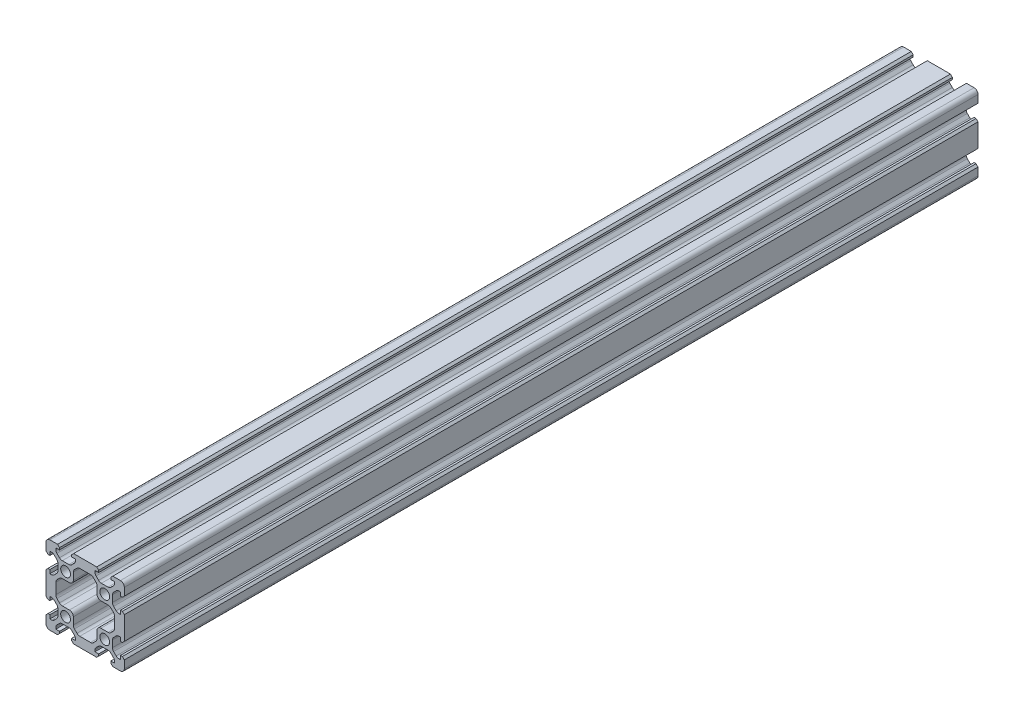
from build123d import *

# Parameters (mm, degrees)
SKETCH1_R           = 2.5
BOSS_EXTRUDE1_DEPTH = 436


with BuildPart() as part:
    # Sketch1 → Boss-Extrude1 (new body)
    with BuildSketch(Plane.XY):
        with BuildLine():
            Line((-13.1, -19), (-14.1, -20))
            Line((-14.1, -20), (-18, -20))
            ThreePointArc((-18, -20), (-19.414213562, -19.414213562), (-20, -18))
            Line((-20, -18), (-20, -14.1))
            Line((-20, -14.1), (-19, -13.1))
            Line((-19, -13.1), (-18, -13.1))
            Line((-18, -13.1), (-18, -15))
            Line((-18, -15), (-17.242640687, -15))
            ThreePointArc((-17.242640687, -15), (-16.477273822, -14.847759065), (-15.828427125, -14.414213562))
            Line((-15.828427125, -14.414213562), (-14.537854624, -13.123641061))
            ThreePointArc((-14.537854624, -13.123641061), (-14.104309121, -12.474794364), (-13.952068186, -11.709427499))
            Line((-13.952068186, -11.709427499), (-13.952068186, -8.290572501))
            ThreePointArc((-13.952068186, -8.290572501), (-14.104309121, -7.525205636), (-14.537854624, -6.876358939))
            Line((-14.537854624, -6.876358939), (-15.828427125, -5.585786438))
            ThreePointArc((-15.828427125, -5.585786438), (-16.477273822, -5.152240935), (-17.242640687, -5))
            Line((-17.242640687, -5), (-18, -5))
            Line((-18, -5), (-18, -6.9))
            Line((-18, -6.9), (-19, -6.9))
            Line((-19, -6.9), (-20, -5.9))
            Line((-20, -5.9), (-20, 5.9))
            Line((-20, 5.9), (-19, 6.9))
            Line((-19, 6.9), (-18, 6.9))
            Line((-18, 6.9), (-18, 5))
            Line((-18, 5), (-17.242640687, 5))
            ThreePointArc((-17.242640687, 5), (-16.477273822, 5.152240935), (-15.828427125, 5.585786438))
            Line((-15.828427125, 5.585786438), (-14.537854624, 6.876358939))
            ThreePointArc((-14.537854624, 6.876358939), (-14.104309121, 7.525205636), (-13.952068186, 8.290572501))
            Line((-13.952068186, 8.290572501), (-13.952068186, 11.709427499))
            ThreePointArc((-13.952068186, 11.709427499), (-14.104309121, 12.474794364), (-14.537854624, 13.123641061))
            Line((-14.537854624, 13.123641061), (-15.828427125, 14.414213562))
            ThreePointArc((-15.828427125, 14.414213562), (-16.477273822, 14.847759065), (-17.242640687, 15))
            Line((-17.242640687, 15), (-18, 15))
            Line((-18, 15), (-18, 13.1))
            Line((-18, 13.1), (-19, 13.1))
            Line((-19, 13.1), (-20, 14.1))
            Line((-20, 14.1), (-20, 18))
            ThreePointArc((-20, 18), (-19.414213562, 19.414213562), (-18, 20))
            Line((-18, 20), (-14.1, 20))
            Line((-14.1, 20), (-13.1, 19))
            Line((-13.1, 19), (-13.1, 18))
            Line((-13.1, 18), (-15, 18))
            Line((-15, 18), (-15, 17.242640687))
            ThreePointArc((-15, 17.242640687), (-14.847759065, 16.477273822), (-14.414213562, 15.828427125))
            Line((-14.414213562, 15.828427125), (-13.123641061, 14.537854624))
            ThreePointArc((-13.123641061, 14.537854624), (-12.474794364, 14.104309121), (-11.709427499, 13.952068186))
            Line((-11.709427499, 13.952068186), (-8.290572501, 13.952068186))
            ThreePointArc((-8.290572501, 13.952068186), (-7.525205636, 14.104309121), (-6.876358939, 14.537854624))
            Line((-6.876358939, 14.537854624), (-5.585786438, 15.828427125))
            ThreePointArc((-5.585786438, 15.828427125), (-5.152240935, 16.477273822), (-5, 17.242640687))
            Line((-5, 17.242640687), (-5, 18))
            Line((-5, 18), (-6.9, 18))
            Line((-6.9, 18), (-6.9, 19))
            Line((-6.9, 19), (-5.9, 20))
            Line((-5.9, 20), (5.9, 20))
            Line((5.9, 20), (6.9, 19))
            Line((6.9, 19), (6.9, 18))
            Line((6.9, 18), (5, 18))
            Line((5, 18), (5, 17.242640687))
            ThreePointArc((5, 17.242640687), (5.152240935, 16.477273822), (5.585786438, 15.828427125))
            Line((5.585786438, 15.828427125), (6.876358939, 14.537854624))
            ThreePointArc((6.876358939, 14.537854624), (7.525205636, 14.104309121), (8.290572501, 13.952068186))
            Line((8.290572501, 13.952068186), (11.709427499, 13.952068186))
            ThreePointArc((11.709427499, 13.952068186), (12.474794364, 14.104309121), (13.123641061, 14.537854624))
            Line((13.123641061, 14.537854624), (14.414213562, 15.828427125))
            ThreePointArc((14.414213562, 15.828427125), (14.847759065, 16.477273822), (15, 17.242640687))
            Line((15, 17.242640687), (15, 18))
            Line((15, 18), (13.1, 18))
            Line((13.1, 18), (13.1, 19))
            Line((13.1, 19), (14.1, 20))
            Line((14.1, 20), (18, 20))
            ThreePointArc((18, 20), (19.414213562, 19.414213562), (20, 18))
            Line((20, 18), (20, 14.1))
            Line((20, 14.1), (19, 13.1))
            Line((19, 13.1), (18, 13.1))
            Line((18, 13.1), (18, 15))
            Line((18, 15), (17.242640687, 15))
            ThreePointArc((17.242640687, 15), (16.477273822, 14.847759065), (15.828427125, 14.414213562))
            Line((15.828427125, 14.414213562), (14.537854624, 13.123641061))
            ThreePointArc((14.537854624, 13.123641061), (14.104309121, 12.474794364), (13.952068186, 11.709427499))
            Line((13.952068186, 11.709427499), (13.952068186, 8.290572501))
            ThreePointArc((13.952068186, 8.290572501), (14.104309121, 7.525205636), (14.537854624, 6.876358939))
            Line((14.537854624, 6.876358939), (15.828427125, 5.585786438))
            ThreePointArc((15.828427125, 5.585786438), (16.477273822, 5.152240935), (17.242640687, 5))
            Line((17.242640687, 5), (18, 5))
            Line((18, 5), (18, 6.9))
            Line((18, 6.9), (19, 6.9))
            Line((19, 6.9), (20, 5.9))
            Line((20, 5.9), (20, -5.9))
            Line((20, -5.9), (19, -6.9))
            Line((19, -6.9), (18, -6.9))
            Line((18, -6.9), (18, -5))
            Line((18, -5), (17.242640687, -5))
            ThreePointArc((17.242640687, -5), (16.477273822, -5.152240935), (15.828427125, -5.585786438))
            Line((15.828427125, -5.585786438), (14.537854624, -6.876358939))
            ThreePointArc((14.537854624, -6.876358939), (14.104309121, -7.525205636), (13.952068186, -8.290572501))
            Line((13.952068186, -8.290572501), (13.952068186, -11.709427499))
            ThreePointArc((13.952068186, -11.709427499), (14.104309121, -12.474794364), (14.537854624, -13.123641061))
            Line((14.537854624, -13.123641061), (15.828427125, -14.414213562))
            ThreePointArc((15.828427125, -14.414213562), (16.477273822, -14.847759065), (17.242640687, -15))
            Line((17.242640687, -15), (18, -15))
            Line((18, -15), (18, -13.1))
            Line((18, -13.1), (19, -13.1))
            Line((19, -13.1), (20, -14.1))
            Line((20, -14.1), (20, -18))
            ThreePointArc((20, -18), (19.414213562, -19.414213562), (18, -20))
            Line((18, -20), (14.1, -20))
            Line((14.1, -20), (13.1, -19))
            Line((13.1, -19), (13.1, -18))
            Line((13.1, -18), (15, -18))
            Line((15, -18), (15, -17.242640687))
            ThreePointArc((15, -17.242640687), (14.847759065, -16.477273822), (14.414213562, -15.828427125))
            Line((14.414213562, -15.828427125), (13.123641061, -14.537854624))
            ThreePointArc((13.123641061, -14.537854624), (12.474794364, -14.104309121), (11.709427499, -13.952068186))
            Line((11.709427499, -13.952068186), (8.290572501, -13.952068186))
            ThreePointArc((8.290572501, -13.952068186), (7.525205636, -14.104309121), (6.876358939, -14.537854624))
            Line((6.876358939, -14.537854624), (5.585786438, -15.828427125))
            ThreePointArc((5.585786438, -15.828427125), (5.152240935, -16.477273822), (5, -17.242640687))
            Line((5, -17.242640687), (5, -18))
            Line((5, -18), (6.9, -18))
            Line((6.9, -18), (6.9, -19))
            Line((6.9, -19), (5.9, -20))
            Line((5.9, -20), (-5.9, -20))
            Line((-5.9, -20), (-6.9, -19))
            Line((-6.9, -19), (-6.9, -18))
            Line((-6.9, -18), (-5, -18))
            Line((-5, -18), (-5, -17.242640687))
            ThreePointArc((-5, -17.242640687), (-5.152240935, -16.477273822), (-5.585786438, -15.828427125))
            Line((-5.585786438, -15.828427125), (-6.876358939, -14.537854624))
            ThreePointArc((-6.876358939, -14.537854624), (-7.525205636, -14.104309121), (-8.290572501, -13.952068186))
            Line((-8.290572501, -13.952068186), (-11.709427499, -13.952068186))
            ThreePointArc((-11.709427499, -13.952068186), (-12.474794364, -14.104309121), (-13.123641061, -14.537854624))
            Line((-13.123641061, -14.537854624), (-14.414213562, -15.828427125))
            ThreePointArc((-14.414213562, -15.828427125), (-14.847759065, -16.477273822), (-15, -17.242640687))
            Line((-15, -17.242640687), (-15, -18))
            Line((-15, -18), (-13.1, -18))
            Line((-13.1, -18), (-13.1, -19))
        make_face()
        with Locations((-10, -10)):
            Circle(SKETCH1_R, mode=Mode.SUBTRACT)
        with Locations((-10, 10)):
            Circle(SKETCH1_R, mode=Mode.SUBTRACT)
        with Locations((10, 10)):
            Circle(SKETCH1_R, mode=Mode.SUBTRACT)
        with Locations((10, -10)):
            Circle(SKETCH1_R, mode=Mode.SUBTRACT)
        with BuildLine():
            Line((-4.171572875, -14.414213562), (-5.462145376, -13.123641061))
            ThreePointArc((-5.462145376, -13.123641061), (-5.895690879, -12.474794364), (-6.047931814, -11.709427499))
            Line((-6.047931814, -11.709427499), (-6.047931814, -8.047931814))
            ThreePointArc((-6.047931814, -8.047931814), (-6.633718252, -6.633718252), (-8.047931814, -6.047931814))
            Line((-8.047931814, -6.047931814), (-11.709427499, -6.047931814))
            ThreePointArc((-11.709427499, -6.047931814), (-12.474794364, -5.895690879), (-13.123641061, -5.462145376))
            Line((-13.123641061, -5.462145376), (-14.414213562, -4.171572875))
            ThreePointArc((-14.414213562, -4.171572875), (-14.847759065, -3.522726178), (-15, -2.757359313))
            Line((-15, -2.757359313), (-15, 2.757359313))
            ThreePointArc((-15, 2.757359313), (-14.847759065, 3.522726178), (-14.414213562, 4.171572875))
            Line((-14.414213562, 4.171572875), (-13.123641061, 5.462145376))
            ThreePointArc((-13.123641061, 5.462145376), (-12.474794364, 5.895690879), (-11.709427499, 6.047931814))
            Line((-11.709427499, 6.047931814), (-8.047931814, 6.047931814))
            ThreePointArc((-8.047931814, 6.047931814), (-6.633718252, 6.633718252), (-6.047931814, 8.047931814))
            Line((-6.047931814, 8.047931814), (-6.047931814, 11.709427499))
            ThreePointArc((-6.047931814, 11.709427499), (-5.895690879, 12.474794364), (-5.462145376, 13.123641061))
            Line((-5.462145376, 13.123641061), (-4.171572875, 14.414213562))
            ThreePointArc((-4.171572875, 14.414213562), (-3.522726178, 14.847759065), (-2.757359313, 15))
            Line((-2.757359313, 15), (2.757359313, 15))
            ThreePointArc((2.757359313, 15), (3.522726178, 14.847759065), (4.171572875, 14.414213562))
            Line((4.171572875, 14.414213562), (5.462145376, 13.123641061))
            ThreePointArc((5.462145376, 13.123641061), (5.895690879, 12.474794364), (6.047931814, 11.709427499))
            Line((6.047931814, 11.709427499), (6.047931814, 8.047931814))
            ThreePointArc((6.047931814, 8.047931814), (6.633718252, 6.633718252), (8.047931814, 6.047931814))
            Line((8.047931814, 6.047931814), (11.709427499, 6.047931814))
            ThreePointArc((11.709427499, 6.047931814), (12.474794364, 5.895690879), (13.123641061, 5.462145376))
            Line((13.123641061, 5.462145376), (14.414213562, 4.171572875))
            ThreePointArc((14.414213562, 4.171572875), (14.847759065, 3.522726178), (15, 2.757359313))
            Line((15, 2.757359313), (15, -2.757359313))
            ThreePointArc((15, -2.757359313), (14.847759065, -3.522726178), (14.414213562, -4.171572875))
            Line((14.414213562, -4.171572875), (13.123641061, -5.462145376))
            ThreePointArc((13.123641061, -5.462145376), (12.474794364, -5.895690879), (11.709427499, -6.047931814))
            Line((11.709427499, -6.047931814), (8.047931814, -6.047931814))
            ThreePointArc((8.047931814, -6.047931814), (6.633718252, -6.633718252), (6.047931814, -8.047931814))
            Line((6.047931814, -8.047931814), (6.047931814, -11.709427499))
            ThreePointArc((6.047931814, -11.709427499), (5.895690879, -12.474794364), (5.462145376, -13.123641061))
            Line((5.462145376, -13.123641061), (4.171572875, -14.414213562))
            ThreePointArc((4.171572875, -14.414213562), (3.522726178, -14.847759065), (2.757359313, -15))
            Line((2.757359313, -15), (-2.757359313, -15))
            ThreePointArc((-2.757359313, -15), (-3.522726178, -14.847759065), (-4.171572875, -14.414213562))
        make_face(mode=Mode.SUBTRACT)
    extrude(amount=BOSS_EXTRUDE1_DEPTH)


solid = part.part
